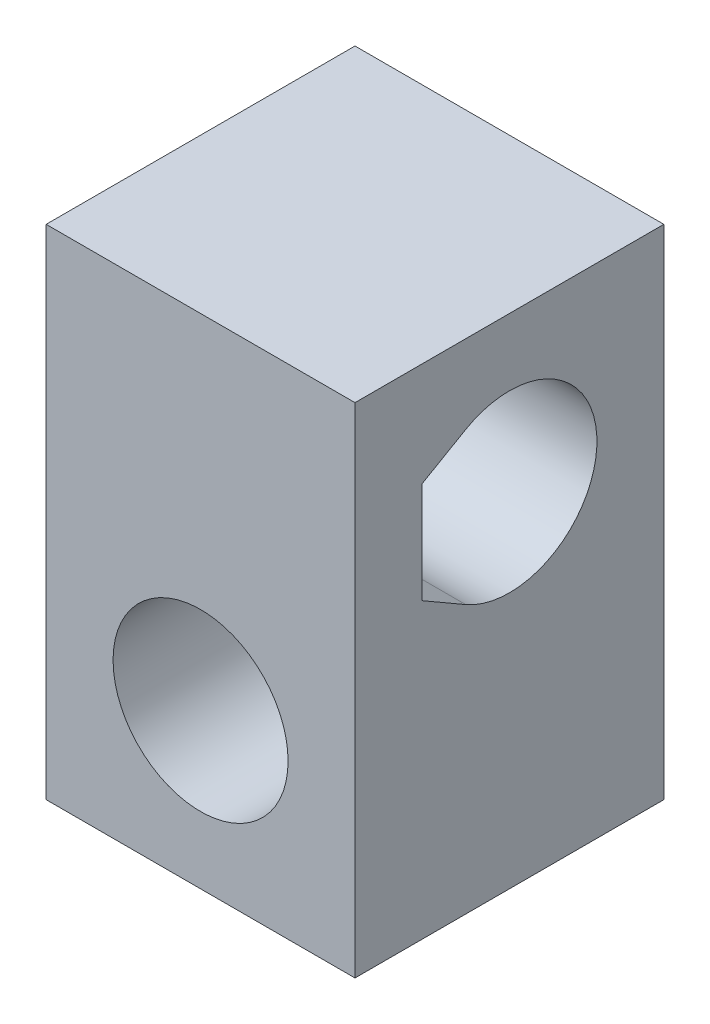
from build123d import *

# Parameters (mm, degrees)
SCHIZZO1_W                   = 15
SCHIZZO1_H                   = 24.2
SCHIZZO1_R                   = 4.25
ESTRUSIONE_ESTRUSIONE1_DEPTH = 7.5
TAGLIO_ESTRUSIONE1_REACH     = 22.68


with BuildPart() as part:
    # Schizzo1 → Estrusione-Estrusione1 (new, symmetric)
    with BuildSketch(Plane.XY):
        Rectangle(SCHIZZO1_W, SCHIZZO1_H)
        with Locations((0, -4.6)):
            Circle(SCHIZZO1_R, mode=Mode.SUBTRACT)
    extrude(amount=ESTRUSIONE_ESTRUSIONE1_DEPTH, both=True)

    # Schizzo2 → Taglio-Estrusione1 (cut, up to next)
    with BuildSketch(Plane.ZY.offset(7.5), mode=Mode.PRIVATE) as taglio_estrusione1_sk1:
        with BuildLine():
            Line((4.25, 2.146261356), (4.25, 7.053738644))
            Line((4.25, 7.053738644), (2.125, 8.280607966))
            ThreePointArc((2.125, 8.280607966), (-4.25, 4.6), (2.125, 0.919392034))
            Line((2.125, 0.919392034), (4.25, 2.146261356))
        make_face()
    taglio_estrusione1_tool1 = extrude(taglio_estrusione1_sk1.sketch, amount=-TAGLIO_ESTRUSIONE1_REACH, mode=Mode.PRIVATE) & part.part
    add(taglio_estrusione1_tool1.solids().sort_by_distance((-7.5, 4.6, 0.125868))[0], mode=Mode.SUBTRACT)


solid = part.part
